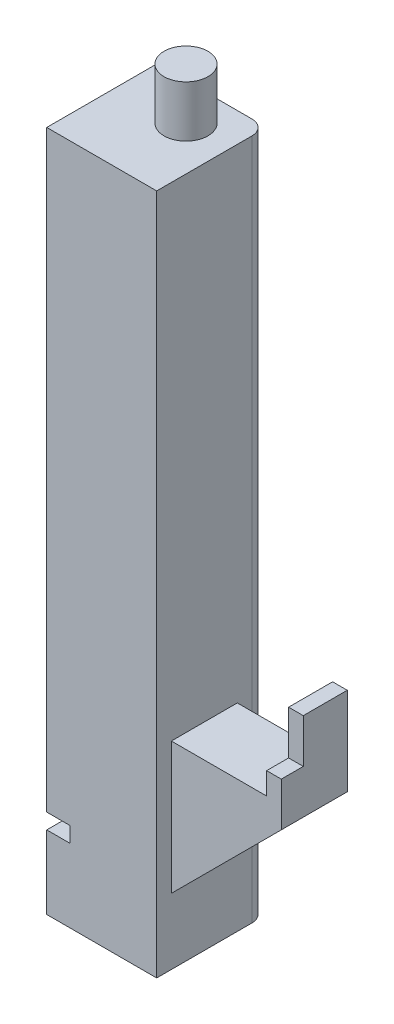
from build123d import *

# Parameters (mm, degrees)
SKETCH1_W           = 15
SKETCH1_H           = 15
BOSS_EXTRUDE1_DEPTH = 93
SKETCH2_R           = 3
BOSS_EXTRUDE2_DEPTH = 7
SKETCH3_W           = 3.2
SKETCH3_H           = 2.1
CUT_EXTRUDE1_DEPTH  = 102.396498953
FILLET1_R           = 2
BOSS_EXTRUDE3_START = -5
BOSS_EXTRUDE3_DEPTH = 6
BOSS_EXTRUDE4_DEPTH = 3
BOSS_EXTRUDE5_DEPTH = 9


with BuildPart() as part:
    # Sketch1 → Boss-Extrude1 (new body)
    with BuildSketch(Plane(origin=(0, 0, 0), x_dir=(1, 0, 0), z_dir=(0, 1, 0))):
        Rectangle(SKETCH1_W, SKETCH1_H)
    extrude(amount=BOSS_EXTRUDE1_DEPTH)

    # Sketch2 → Boss-Extrude2 (add)
    with BuildSketch(Plane(origin=(0, 93, 0), x_dir=(1, 0, 0), z_dir=(0, 1, 0))):
        with Locations(Location((1.5, 2.5, 0), (0, 0, 270))):
            Circle(SKETCH2_R)
    extrude(amount=BOSS_EXTRUDE2_DEPTH)

    # Sketch3 → Cut-Extrude1 (cut, through all)
    with BuildSketch(Plane.XY.offset(7.5)):
        with Locations((-5.9, 11.05)):
            Rectangle(SKETCH3_W, SKETCH3_H)
    extrude(amount=-CUT_EXTRUDE1_DEPTH, mode=Mode.SUBTRACT)

    # Fillet1
    fillet1_edges = [part.edges().sort_by_distance(p)[0] for p in [
        (7.5, 46.5, -7.5),
    ]]
    fillet(fillet1_edges, radius=FILLET1_R)

    # Sketch4 → Boss-Extrude3 (add)
    with BuildSketch(Plane.XY.offset(7.5).offset(BOSS_EXTRUDE3_START)):
        Polygon((7.5, 24), (22.5, 24), (22.5, 36), (20.5, 36), (20.5, 27), (7.5, 27), align=None)
    extrude(amount=-BOSS_EXTRUDE3_DEPTH)

    # Sketch5 → Boss-Extrude4 (add)
    with BuildSketch(Plane.XY.offset(2.5)):
        Polygon((20.5, 30), (22.5, 30), (22.5, 24), (7.5, 24), (7.5, 27), (20.5, 27), align=None)
    extrude(amount=BOSS_EXTRUDE4_DEPTH)

    # Sketch6 → Boss-Extrude5 (add)
    with BuildSketch(Plane.XY.offset(5.5)):
        Polygon((22.5, 24), (7.5, 24), (7.5, 9), align=None)
    extrude(amount=-BOSS_EXTRUDE5_DEPTH)


solid = part.part
